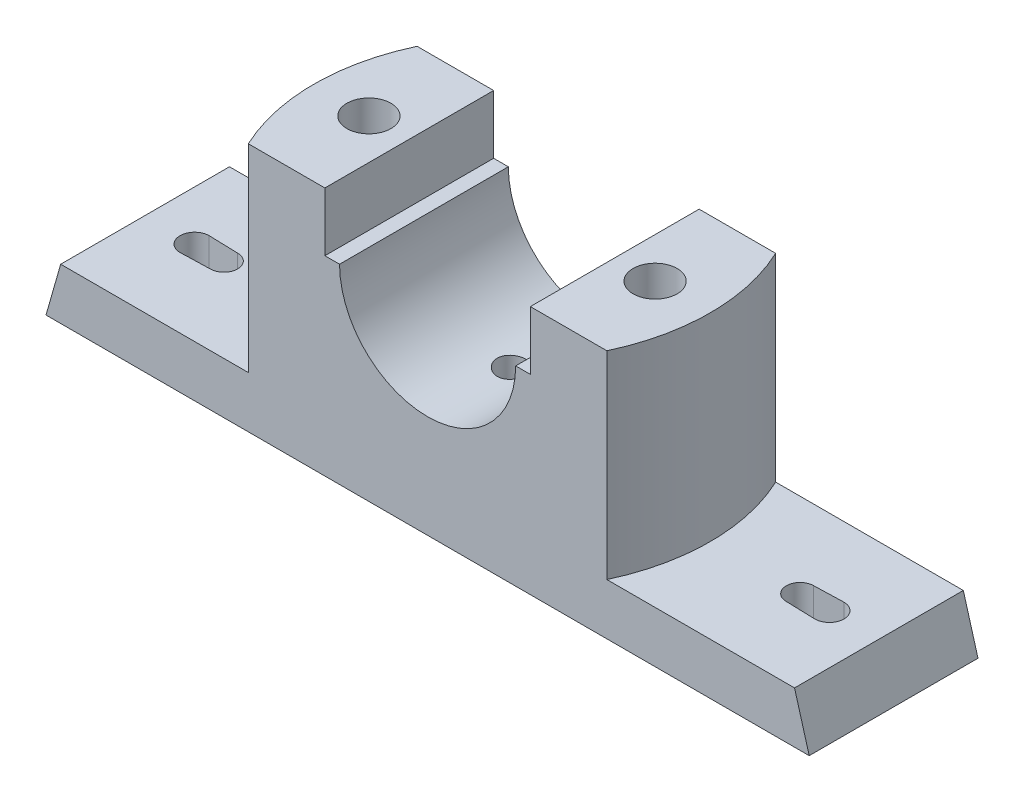
from build123d import *

# Parameters (mm, degrees)
BOSS_EXTRUDE1_DEPTH = 23
SKETCH2_R           = 6
CUT_EXTRUDE1_DEPTH  = 127.368508735
CUT_EXTRUDE2_DEPTH  = 54
CUT_EXTRUDE3_DEPTH  = 120.419428905
SKETCH5_R           = 4
CUT_EXTRUDE18_DEPTH = 24
SKETCH6_W           = 26
SKETCH6_H           = 26
CUT_EXTRUDE19_DEPTH = 10


with BuildPart() as part:
    # Sketch1 → Boss-Extrude1 (new, symmetric)
    with BuildSketch(Plane.XY):
        with BuildLine():
            Line((100, 4.470588235), (104, -9.529411765))
            Line((104, -9.529411765), (-104, -9.529411765))
            Line((-104, -9.529411765), (-100, 4.470588235))
            Line((-100, 4.470588235), (-54, 4.470588235))
            Line((-54, 4.470588235), (-54, 58.470588235))
            Line((-54, 58.470588235), (-28, 58.470588235))
            Line((-28, 58.470588235), (-28, 42.470588235))
            Line((-28, 42.470588235), (-24, 42.470588235))
            ThreePointArc((-24, 42.470588235), (0, 18.470588235), (24, 42.470588235))
            Line((24, 42.470588235), (28, 42.470588235))
            Line((28, 42.470588235), (28, 58.470588235))
            Line((28, 58.470588235), (54, 58.470588235))
            Line((54, 58.470588235), (54, 4.470588235))
            Line((54, 4.470588235), (100, 4.470588235))
        make_face()
    extrude(amount=BOSS_EXTRUDE1_DEPTH, both=True)

    # Sketch2 → Cut-Extrude1 (cut, through all)
    with BuildSketch(Plane(origin=(0, 58.470588235, 0), x_dir=(1, 0, 0), z_dir=(0, 1, 0))):
        with Locations(Location((-39, 0, 0), (0, 0, 270))):
            Circle(SKETCH2_R)
        with Locations(Location((39, 0, 0), (0, 0, 270))):
            Circle(SKETCH2_R)
    extrude(amount=-CUT_EXTRUDE1_DEPTH, mode=Mode.SUBTRACT)

    # Sketch3 → Cut-Extrude2 (cut)
    with BuildSketch(Plane(origin=(0, 58.470588235, 0), x_dir=(1, 0, 0), z_dir=(0, 1, 0))):
        with BuildLine():
            Line((-48.856934001, 23), (-69.801648505, 23))
            Line((-69.801648505, 23), (-69.801648505, -23))
            Line((-69.801648505, -23), (-48.856934001, -23))
            ThreePointArc((-48.856934001, -23), (-54, 0), (-48.856934001, 23))
        make_face()
        with BuildLine():
            Line((69.801648505, -23), (48.856934001, -23))
            ThreePointArc((48.856934001, -23), (54, 0), (48.856934001, 23))
            Line((48.856934001, 23), (69.801648505, 23))
            Line((69.801648505, 23), (69.801648505, -23))
        make_face()
    extrude(amount=-CUT_EXTRUDE2_DEPTH, mode=Mode.SUBTRACT)

    # Sketch4 → Cut-Extrude3 (cut, through all)
    with BuildSketch(Plane(origin=(0, 4.470588235, 0), x_dir=(1, 0, 0), z_dir=(0, 1, 0))):
        with BuildLine():
            Line((-86.259028478, 3.967568831), (-86.5, 3.974879835))
            ThreePointArc((-86.5, 3.974879835), (-90.474879835, 0), (-86.5, -3.974879835))
            Line((-86.5, -3.974879835), (-86.259028478, -3.967568831))
            Line((-86.259028478, -3.967568831), (-78.5, -3.732162222))
            ThreePointArc((-78.5, -3.732162222), (-74.767837778, 0), (-78.5, 3.732162222))
            Line((-78.5, 3.732162222), (-86.259028478, 3.967568831))
        make_face()
    cut_extrude3 = extrude(amount=-CUT_EXTRUDE3_DEPTH, mode=Mode.SUBTRACT)

    # Mirror1: Cut-Extrude3 across plane
    add(cut_extrude3.mirror(Plane(origin=(0, 0, 0), x_dir=(0, 0, 1), z_dir=(1, 0, 0))), mode=Mode.SUBTRACT)

    # Sketch5 → Cut-Extrude18 (cut)
    with BuildSketch(Plane(origin=(0, 28.470588235, 0), x_dir=(1, 0, 0), z_dir=(0, 1, 0))):
        with Locations(Location((0, 0, 0), (0, 0, 270))):
            Circle(SKETCH5_R)
    extrude(amount=-CUT_EXTRUDE18_DEPTH, mode=Mode.SUBTRACT)

    # Sketch6 → Cut-Extrude19 (cut)
    with BuildSketch(Plane.XZ.offset(9.529411765)):
        with Locations((-39, 0)):
            Rectangle(SKETCH6_W, SKETCH6_H)
        with Locations((39, 0)):
            Rectangle(SKETCH6_W, SKETCH6_H)
    extrude(amount=-CUT_EXTRUDE19_DEPTH, mode=Mode.SUBTRACT)


solid = part.part
